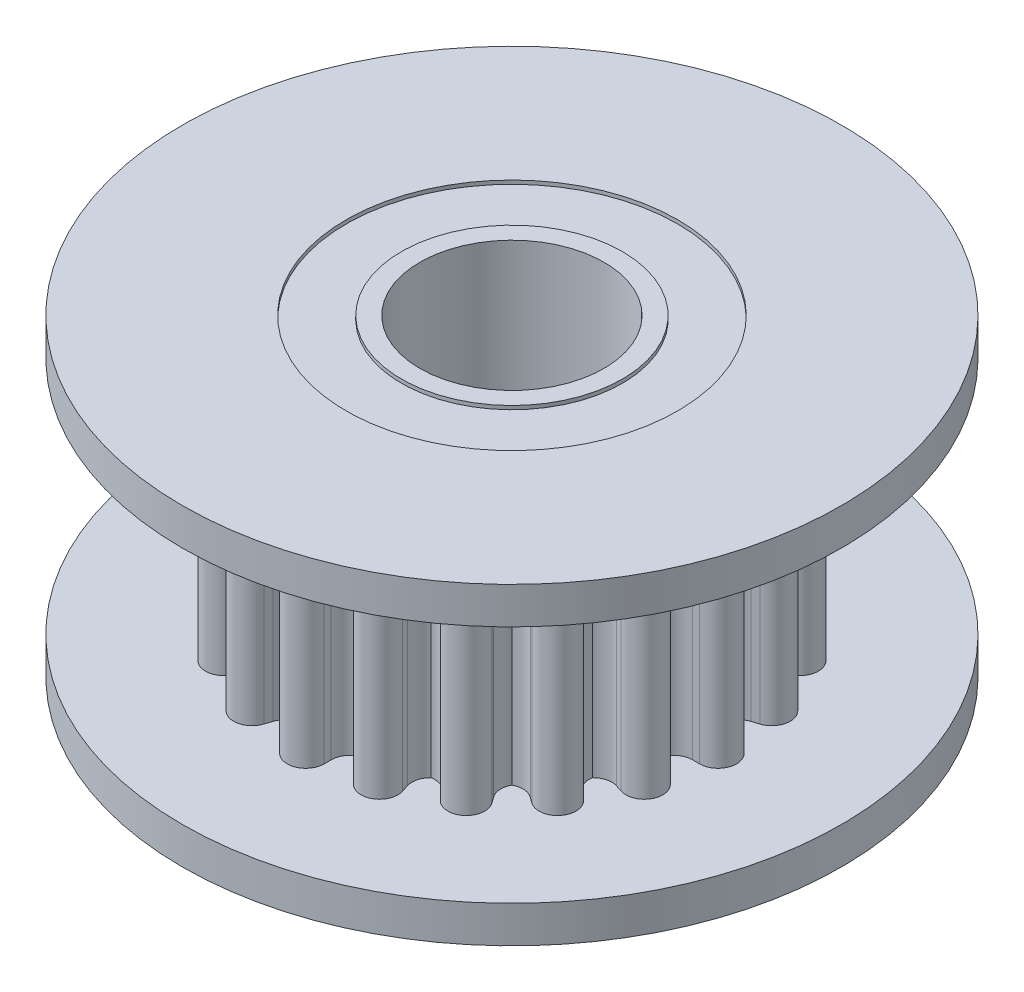
from build123d import *

# Parameters (mm, degrees)
SKETCH1_R           = 8.95
SKETCH1_R_2         = 2.5
BOSS_EXTRUDE1_DEPTH = 1
SKETCH2_R           = 5
SKETCH2_R_2         = 2.5
BOSS_EXTRUDE2_DEPTH = 3.25
BOSS_EXTRUDE3_DEPTH = 3.25
CIRPATTERN1_COUNT   = 20
SKETCH4_R           = 4.5
SKETCH4_R_2         = 3
CUT_EXTRUDE1_DEPTH  = 0.1


with BuildPart() as part:
    # Sketch1 → Boss-Extrude1 (new body)
    with BuildSketch(Plane(origin=(0, 0, 0), x_dir=(1, 0, 0), z_dir=(0, 1, 0))):
        with Locations(Location((0, 0, 0), (0, 0, 270))):
            Circle(SKETCH1_R)
        with Locations(Location((0, 0, 0), (0, 0, 270))):
            Circle(SKETCH1_R_2, mode=Mode.SUBTRACT)
    extrude(amount=BOSS_EXTRUDE1_DEPTH)

    # Sketch2 → Boss-Extrude2 (add)
    with BuildSketch(Plane(origin=(0, 1, 0), x_dir=(1, 0, 0), z_dir=(0, 1, 0))):
        with Locations(Location((0, 0, 0), (0, 0, 90))):
            Circle(SKETCH2_R)
        with Locations(Location((0, 0, 0), (0, 0, 270))):
            Circle(SKETCH2_R_2, mode=Mode.SUBTRACT)
    extrude(amount=BOSS_EXTRUDE2_DEPTH)

    # Sketch3 → Boss-Extrude3 (add)
    with BuildSketch(Plane(origin=(0, 1, 0), x_dir=(1, 0, 0), z_dir=(0, 1, 0))):
        with BuildLine():
            Line((0.5, 5.6), (0.5, 5.408326913))
            ThreePointArc((0.5, 5.408326913), (0.615646943, 5.088525839), (0.909090909, 4.91666083))
            Line((0.909090909, 4.91666083), (-0.909090909, 4.91666083))
            ThreePointArc((-0.909090909, 4.91666083), (-0.615646943, 5.088525839), (-0.5, 5.408326913))
            Line((-0.5, 5.408326913), (-0.5, 5.6))
            ThreePointArc((-0.5, 5.6), (0, 6.1), (0.5, 5.6))
        make_face()
    boss_extrude3 = extrude(amount=BOSS_EXTRUDE3_DEPTH)

    # CirPattern1: Boss-Extrude3 ×20 about axis
    cirpattern1_axis = Axis((0, 0, 0), (0, 1, 0))
    for i in range(1, CIRPATTERN1_COUNT):
        add(boss_extrude3.rotate(cirpattern1_axis, i * 360 / CIRPATTERN1_COUNT))

    # Sketch4 → Cut-Extrude1 (cut)
    with BuildSketch(Plane.XZ):
        with Locations(Location((0, 0, 0), (0, 0, 270))):
            Circle(SKETCH4_R)
        with Locations(Location((0, 0, 0), (0, 0, 270))):
            Circle(SKETCH4_R_2, mode=Mode.SUBTRACT)
    extrude(amount=-CUT_EXTRUDE1_DEPTH, mode=Mode.SUBTRACT)

    # Mirror1: part across plane


with BuildPart() as part_1:
    add(part.part)
    add(part.part.mirror(Plane.ZX.offset(4.25)))


solid = part_1.part
